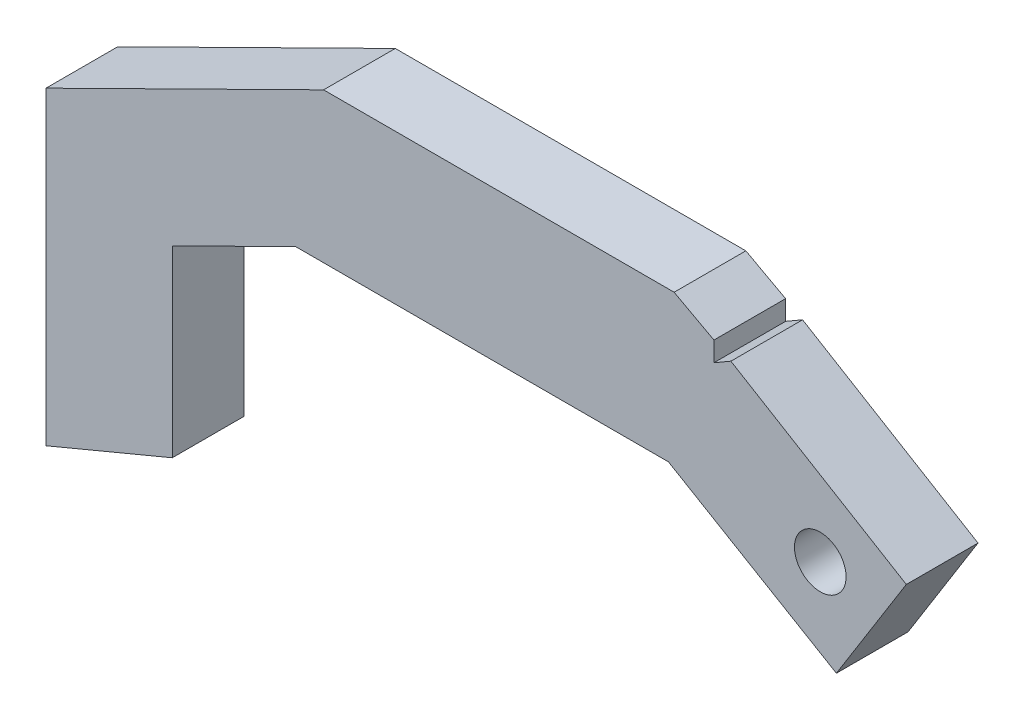
from build123d import *

# Parameters (mm, degrees)
SKETCH2_R           = 1.143
BOSS_EXTRUDE1_DEPTH = 3.175


with BuildPart() as part:
    # Sketch2 → Boss-Extrude1 (new body)
    with BuildSketch(Plane.XY):
        Polygon((-15.64946208, -2.754628495), (-13.88819212, -3.707506284), (-13.88819212, -4.578373687), (-13.136079363, -4.142939985), (-5.367770719, -8.821148647), (-8.4639806, -13.775182193), (-15.901799882, -9.3866357), (-32.411799882, -9.3866357), (-37.875691596, -12.08980113), (-37.875691596, -20.21780113), (-43.467770719, -22.552750714), (-43.467770719, -8.836750714), (-31.174014364, -2.754628495), align=None)
        with Locations((-9.177770719, -9.865122974)):
            Circle(SKETCH2_R, mode=Mode.SUBTRACT)
    extrude(amount=BOSS_EXTRUDE1_DEPTH)


solid = part.part
